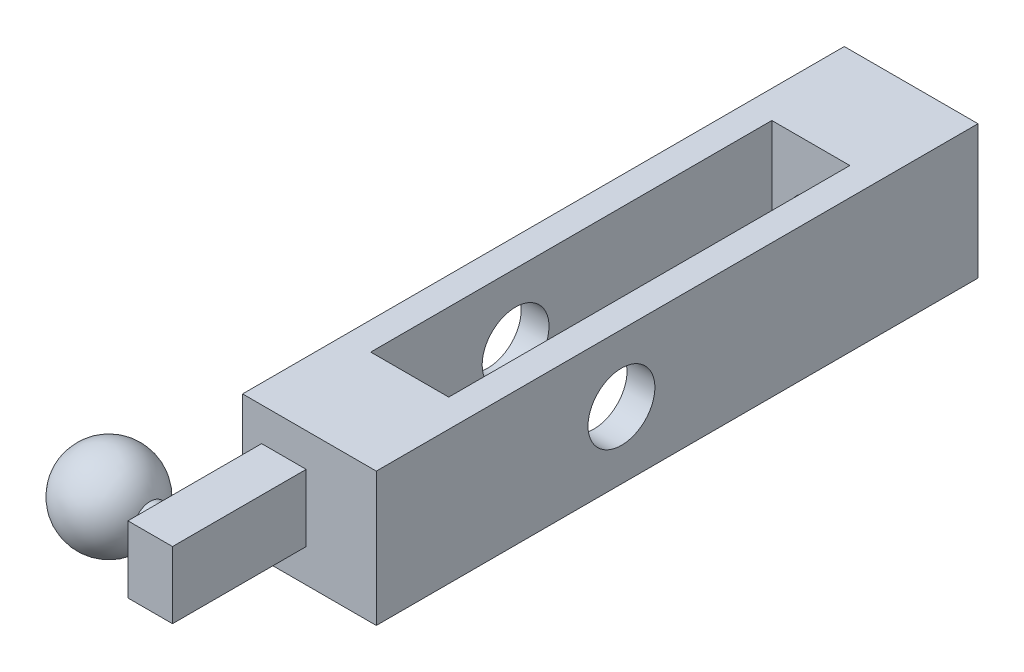
from build123d import *

# Parameters (mm, degrees)
SKETCH_1_W          = 6
SKETCH_1_H          = 6
EXTRUDE_1_DEPTH     = 27
SKETCH_2_W          = 2
SKETCH_2_H          = 3
EXTRUDE_2_DEPTH     = 6
SKETCH_3_R          = 0.75
EXTRUDE_3_DEPTH     = 1
SKETCH_5_W          = 18
SKETCH_5_H          = 3.5
CUT_EXTRUDE_1_DEPTH = 8
SKETCH_6_R          = 1.5
CUT_EXTRUDE_2_DEPTH = 8
SKETCH_7_R          = 0.9
CUT_EXTRUDE_3_DEPTH = 8


with BuildPart() as part:
    # 草图1 → 凸台-拉伸1 (new body)
    with BuildSketch(Plane.XY):
        Rectangle(SKETCH_1_W, SKETCH_1_H)
    extrude(amount=EXTRUDE_1_DEPTH)

    # 草图2 → 凸台-拉伸2 (add)
    with BuildSketch(Plane.XY.offset(27)):
        with Locations((-1.14479355, -0.004540815)):
            Rectangle(SKETCH_2_W, SKETCH_2_H)
    extrude(amount=EXTRUDE_2_DEPTH)

    # 草图3 → 凸台-拉伸3 (add)
    with BuildSketch(Plane.ZY.offset(2.14479355)):
        with Locations(Location((31, 0, 0), (0, 0, 90))):
            Circle(SKETCH_3_R)
    extrude(amount=EXTRUDE_3_DEPTH)

    # 草图4 → 旋转1 (revolve)
    with BuildSketch(Plane(origin=(0, 0, 0), x_dir=(1, 0, 0), z_dir=(0, 1, 0))):
        with BuildLine():
            Line((-3.14479355, -31), (-6.998843172, -31))
            ThreePointArc((-6.998843172, -31), (-5.380877697, -29.036826645), (-3.14479355, -30.25))
            Line((-3.14479355, -30.25), (-3.14479355, -31))
        make_face()
    revolve(axis=Axis((-3.14479355, 0, 31), (-1, 0, 0)))

    # 草图5 → 切除-拉伸1 (cut)
    with BuildSketch(Plane(origin=(0.5, 3, 0), x_dir=(0, 0, 1), z_dir=(0, -1, 0))):
        with Locations((13.5, 0.5)):
            Rectangle(SKETCH_5_W, SKETCH_5_H)
    extrude(amount=CUT_EXTRUDE_1_DEPTH, mode=Mode.SUBTRACT)

    # 草图6 → 切除-拉伸2 (cut)
    with BuildSketch(Plane.ZY.offset(3)):
        with Locations((16, 0)):
            Circle(SKETCH_6_R)
    extrude(amount=-CUT_EXTRUDE_2_DEPTH, mode=Mode.SUBTRACT)

    # 草图7 → 切除-拉伸3 (cut)
    with BuildSketch(Plane(origin=(0, 0, 0), x_dir=(-1, 0, 0), z_dir=(0, 0, -1))):
        Circle(SKETCH_7_R)
    extrude(amount=-CUT_EXTRUDE_3_DEPTH, mode=Mode.SUBTRACT)


solid = part.part
